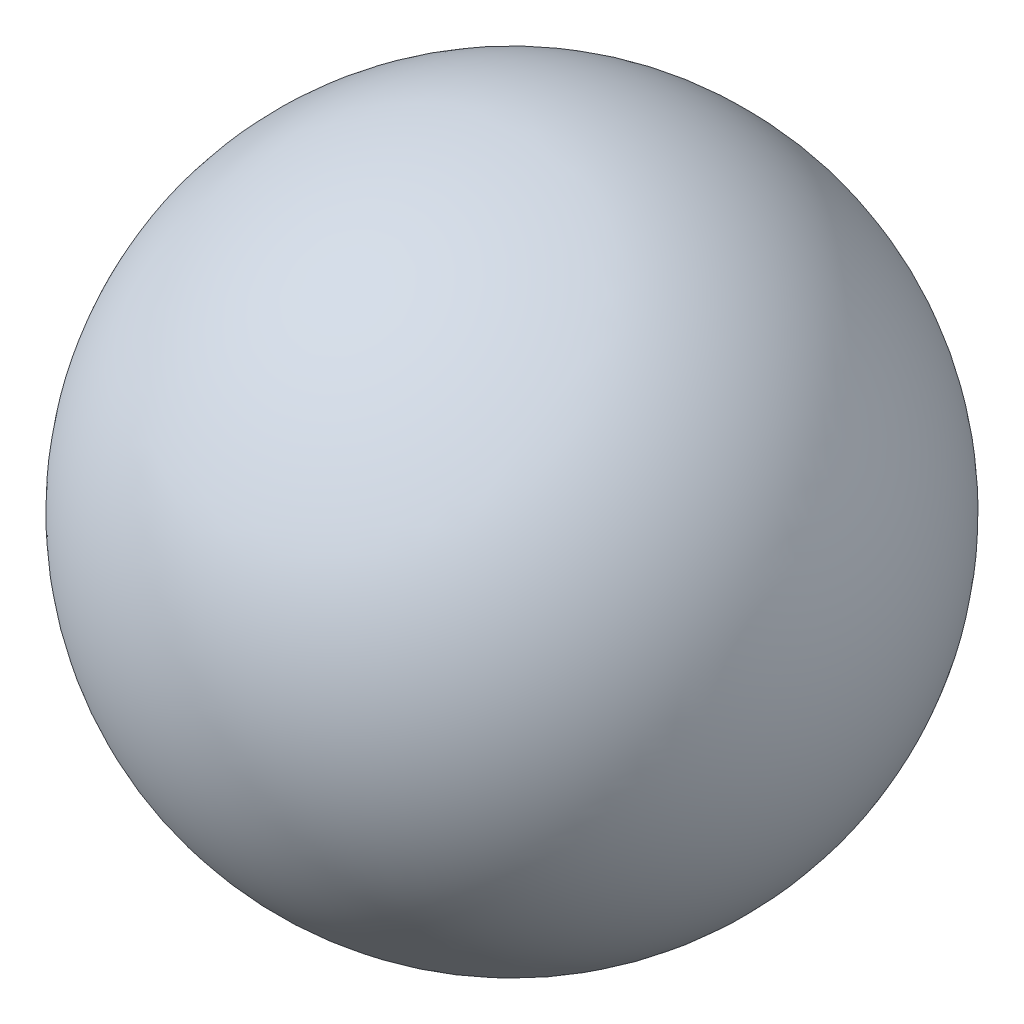
from build123d import *


with BuildPart() as part:
    # Sketch1 → Revolve1 (revolve)
    with BuildSketch(Plane.XY):
        with BuildLine():
            Line((-139.7, 0), (139.7, 0))
            ThreePointArc((139.7, 0), (0, -139.7), (-139.7, 0))
        make_face()
    revolve(axis=Axis((-139.7, 0, 0), (1, 0, 0)))


solid = part.part
